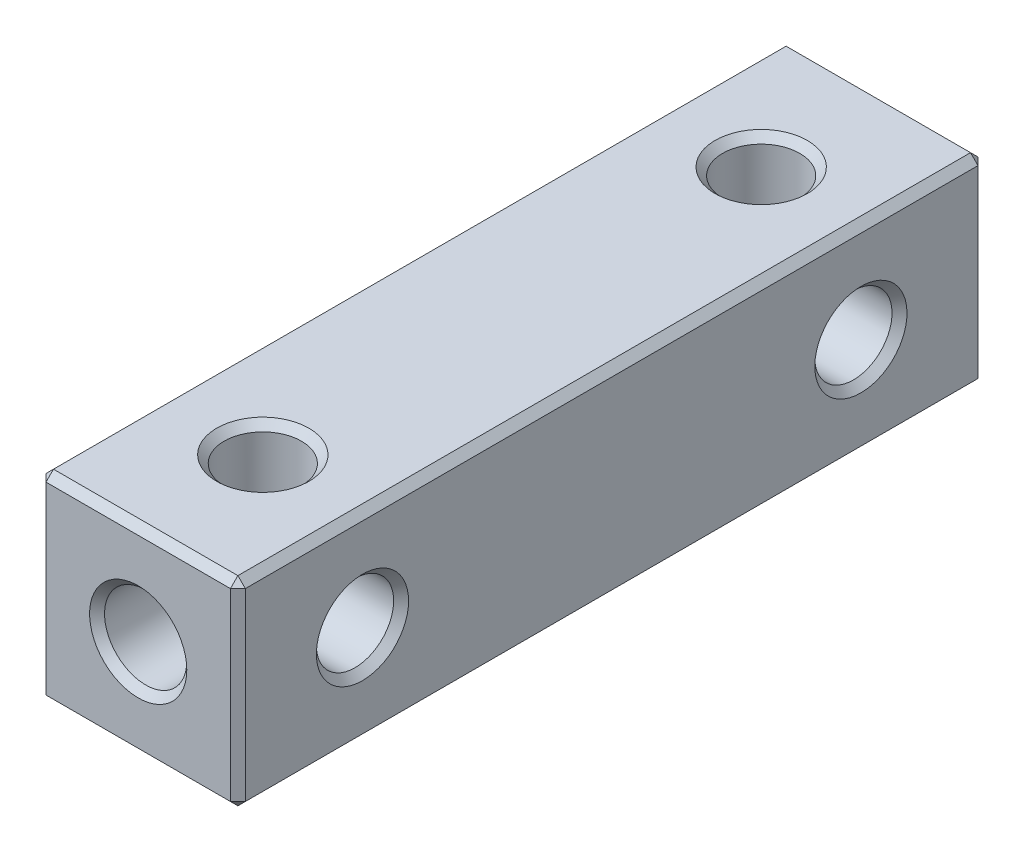
from build123d import *

# Parameters (mm, degrees)
SKETCH_1_W              = 8
SKETCH_1_H              = 8
EXTRUDE_1_DEPTH         = 15
HOLE_WIZARD_3_1_3_1_1_D = 3.1
HOLE_WIZARD_3_1_3_1_2_D = 3.1
HOLE_WIZARD_M4_1_REACH  = 32.529
HOLE_WIZARD_M4_1_BORE_R = 1.65
HOLE_WIZARD_M4_2_REACH  = 32.529
HOLE_WIZARD_M4_2_BORE_R = 1.65
CHAMFER_1_SIZE          = 0.3


with BuildPart() as part:
    # 草图1 → 凸台-拉伸1 (new, symmetric)
    with BuildSketch(Plane.XY):
        Rectangle(SKETCH_1_W, SKETCH_1_H)
    extrude(amount=EXTRUDE_1_DEPTH, both=True)

    # Ø3.1 (3.1) 直径孔1 (through all)
    with Locations(Plane(origin=(4, 0, 0), x_dir=(0, 0, -1), z_dir=(1, 0, 0))):
        with Locations((-10, 0), (10, 0)):
            Hole(HOLE_WIZARD_3_1_3_1_1_D / 2)

    # Ø3.1 (3.1) 直径孔2 (through all)
    with Locations(Plane(origin=(0, 4, 0), x_dir=(1, 0, 0), z_dir=(0, 1, 0))):
        with Locations((0, -10), (0, 10)):
            Hole(HOLE_WIZARD_3_1_3_1_2_D / 2)

    # M4 螺纹孔1 bore → M4 螺纹孔1 (cut, up to next)
    with BuildSketch(Plane.XY.offset(15), mode=Mode.PRIVATE) as hole_wizard_m4_1_sk1:
        Circle(HOLE_WIZARD_M4_1_BORE_R)
    hole_wizard_m4_1_tool1 = extrude(hole_wizard_m4_1_sk1.sketch, amount=-HOLE_WIZARD_M4_1_REACH, mode=Mode.PRIVATE) & part.part
    add(hole_wizard_m4_1_tool1.solids().sort_by_distance((0, 0, 15))[0], mode=Mode.SUBTRACT)

    # M4 螺纹孔2 bore → M4 螺纹孔2 (cut, up to next)
    with BuildSketch(Plane(origin=(0, 0, -15), x_dir=(-1, 0, 0), z_dir=(0, 0, -1)), mode=Mode.PRIVATE) as hole_wizard_m4_2_sk1:
        Circle(HOLE_WIZARD_M4_2_BORE_R)
    hole_wizard_m4_2_tool1 = extrude(hole_wizard_m4_2_sk1.sketch, amount=-HOLE_WIZARD_M4_2_REACH, mode=Mode.PRIVATE) & part.part
    add(hole_wizard_m4_2_tool1.solids().sort_by_distance((0, 0, -15))[0], mode=Mode.SUBTRACT)

    # 倒角1
    chamfer_1_edges = [part.edges().sort_by_distance(p)[0] for p in [
        (-4, 0, 15),
        (4, 0, -11.55),
        (-4, 0, -11.55),
        (0, -4, 15),
        (4, 0, 8.45),
        (-4, 0, 8.45),
        (1.55, -4, -10),
        (1.55, 4, -10),
        (1.55, -4, 10),
        (1.55, 4, 10),
        (4, 0, 15),
        (0, -4, -15),
        (-4, 0, -15),
        (-1.65, 0, 15),
        (0, 4, -15),
        (4, 0, -15),
        (1.65, 0, -15),
        (4, -4, 0),
        (-4, -4, 0),
        (-4, 4, 0),
        (4, 4, 0),
        (0, 4, 15),
    ]]
    chamfer(chamfer_1_edges, length=CHAMFER_1_SIZE)


solid = part.part
